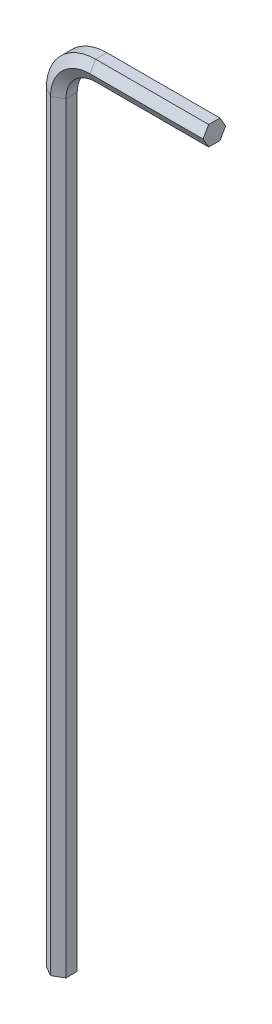
from build123d import *


with BuildPart() as part:
    # Sweep1: sweep along a path in Sketch1
    with BuildLine(Plane.XY) as sweep1_path:
        Line((0, 0), (0, 77.2094))
        ThreePointArc((0, 77.2094), (1.171572875, 80.037827125), (4, 81.2094))
        Line((4, 81.2094), (15.4694, 81.2094))
    # Sketch2 → Sweep1 (sweep)
    with BuildSketch(Plane(origin=(0, 0, 0), x_dir=(1, 0, 0), z_dir=(0, 1, 0))):
        Polygon((-0.9906, 0.571923177), (-0.9906, -0.571923177), (0, -1.143846353), (0.9906, -0.571923177), (0.9906, 0.571923177), (0, 1.143846353), align=None)
    sweep(path=sweep1_path.line)


solid = part.part
